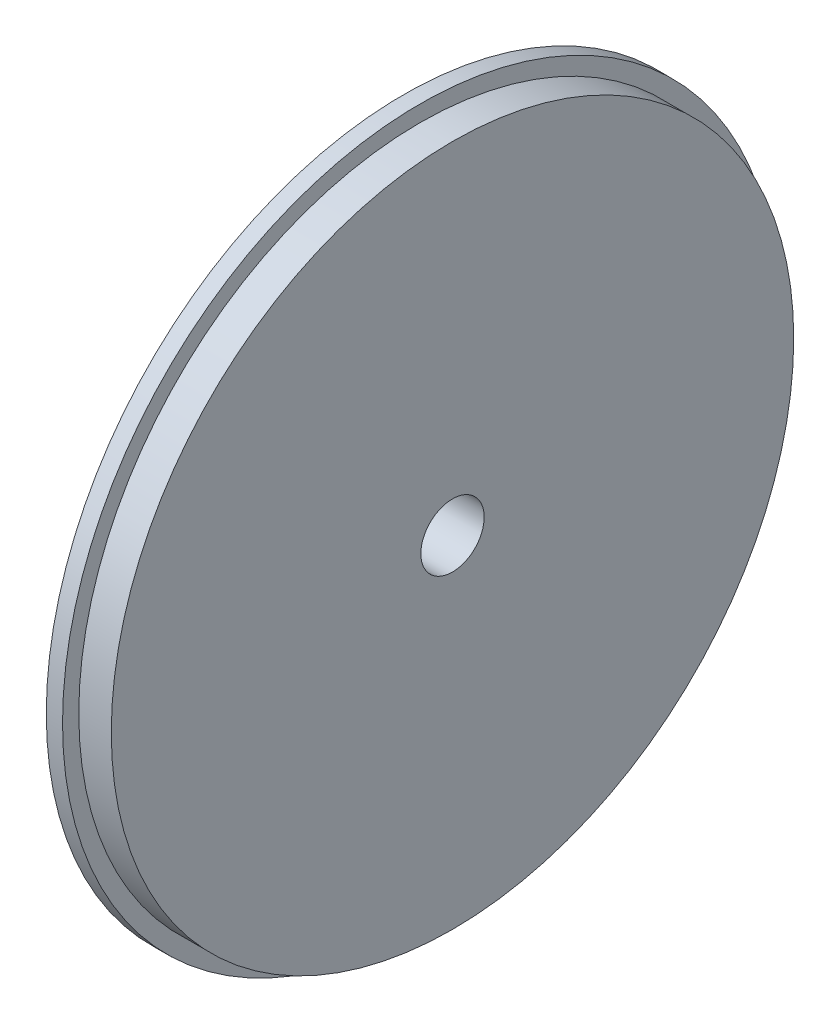
from build123d import *


with BuildPart() as part:
    # Sketch1 → Revolve1 (revolve)
    with BuildSketch(Plane.XY, mode=Mode.PRIVATE) as revolve1_sk:
        Polygon((-0.75, 11), (-0.25, 11), (-0.25, 10.5), (0.75, 10.5), (0.75, 0.975), (-0.75, 0.975), align=None)
    revolve(revolve1_sk.sketch.rotate(Axis((-0.75, 0, 0), (1, 0, 0)), 90), axis=Axis((-0.75, 0, 0), (1, 0, 0)))


solid = part.part
